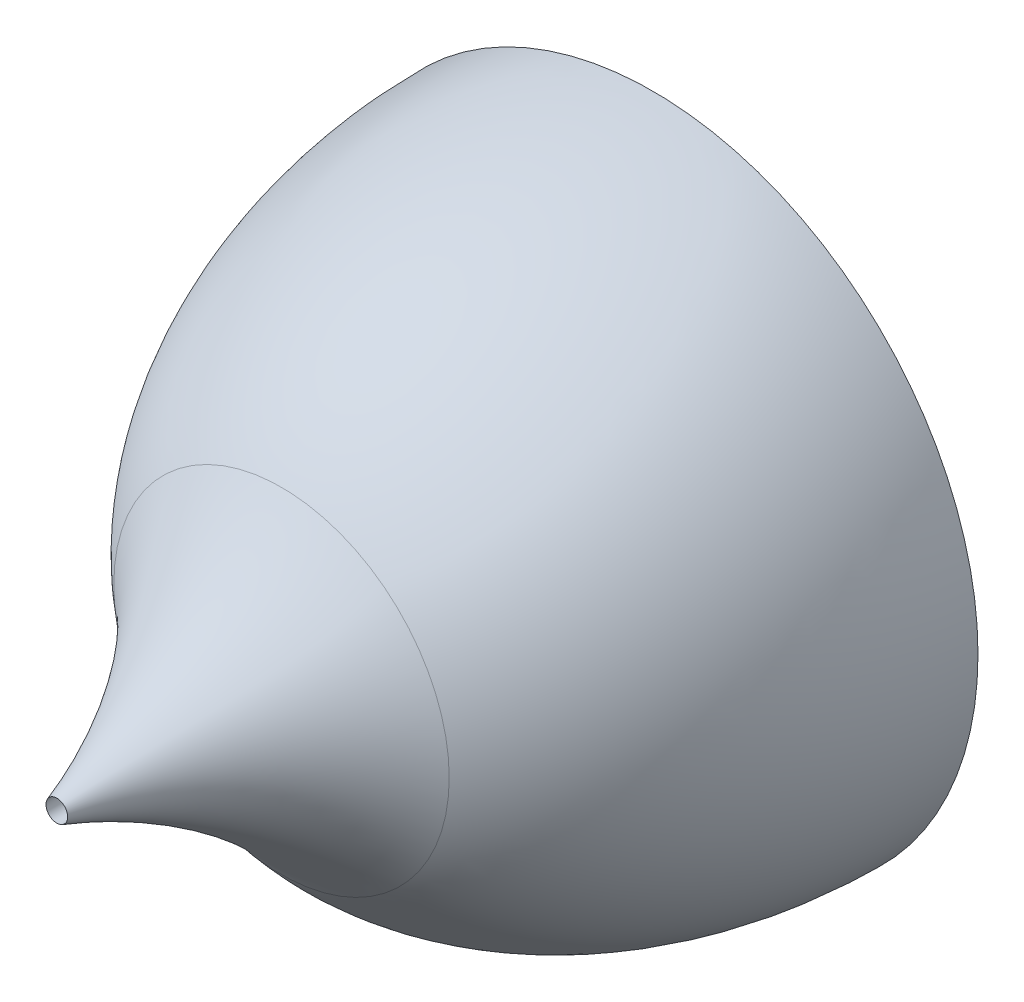
from build123d import *


with BuildPart() as part:
    # Esquisse3 → Révolution1 (revolve)
    with BuildSketch(Plane(origin=(0, 0, 0), x_dir=(1, 0, 0), z_dir=(0, 1, 0))):
        with BuildLine():
            Line((-15, 0), (-12, 0))
            add(Edge.make_bspline(
                [(-12, 0), (-12, -16.305827179), (-0.5, -16.985236645)],
                knots=[1.570796327, 1.570796327, 1.570796327, 3.099913921, 3.099913921, 3.099913921], degree=2, weights=[1, 0.721687836, 1]))
            Line((-0.5, -16.985236645), (-0.5, -27.5))
            ThreePointArc((-0.5, -27.5), (-3.375793576, -21.797942718), (-7.737792446, -17.133544386))
            add(Edge.make_bspline(
                [(-15, 0), (-15, -11.302907545), (-7.737792446, -17.133544386)],
                knots=[4.71238898, 4.71238898, 4.71238898, 5.741182447, 5.741182447, 5.741182447], degree=2, weights=[1, 0.870589694, 1]))
        make_face()
    revolve(axis=Axis((0, 0, -24.480898243), (0, 0, 1)))


solid = part.part
